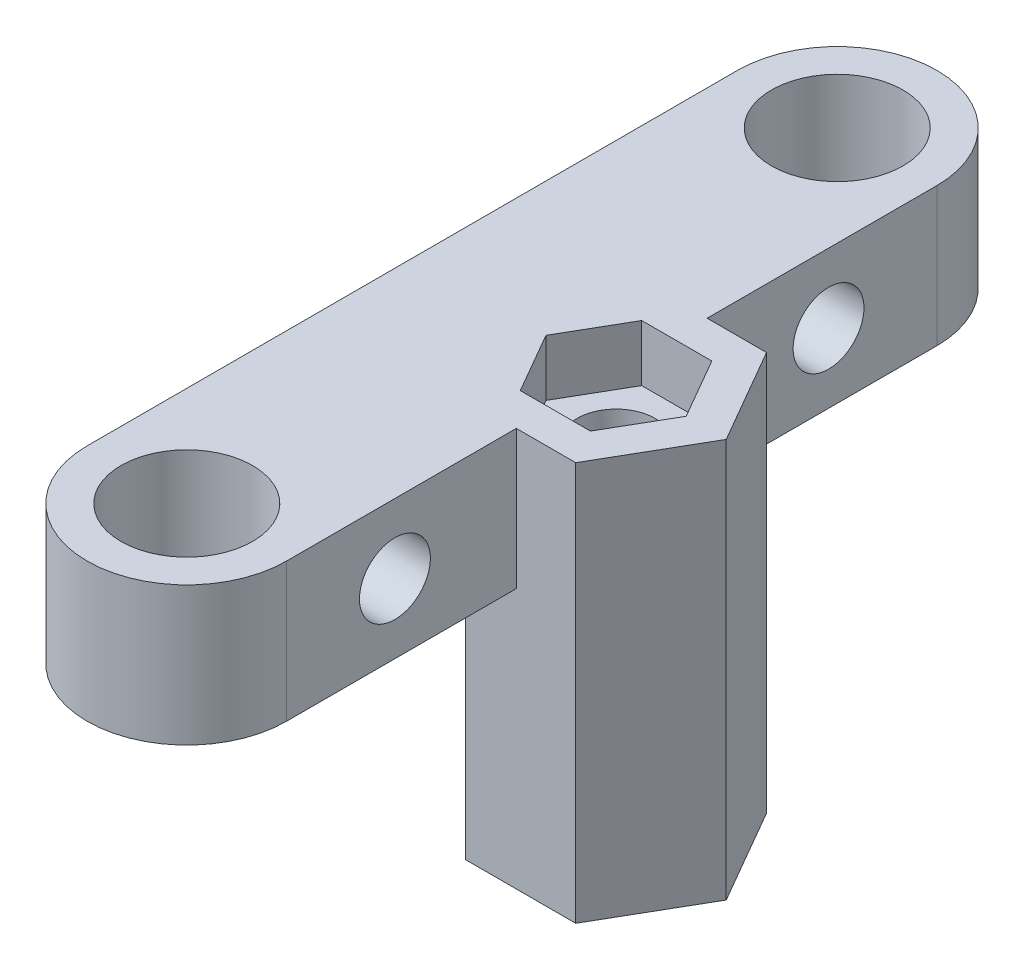
from build123d import *

# Parameters (mm, degrees)
SKETCH1_R           = 7.5875
BOSS_EXTRUDE1_DEPTH = 16
SKETCH2_R           = 4.0875
CUT_EXTRUDE1_DEPTH  = 63.988598267
SKETCH1_6_R         = 4.5
BOSS_EXTRUDE2_DEPTH = 9.5
BOSS_EXTRUDE3_DEPTH = 30


with BuildPart() as part:
    # Sketch1 → Boss-Extrude1 (new body)
    with BuildSketch(Plane(origin=(0, 0, 0), x_dir=(1, 0, 0), z_dir=(0, 1, 0))):
        with BuildLine():
            Line((-23.5, -33), (-23.5, 33))
            Line((-23.5, 33), (-23.5, 37.5))
            ThreePointArc((-23.5, 37.5), (-12, 49), (-0.5, 37.5))
            Line((-0.5, 37.5), (-0.5, 33))
            Line((-0.5, 33), (-0.5, 11))
            Line((-0.5, 11), (6.350852961, 11))
            Line((6.350852961, 11), (12.701705922, 0))
            Line((12.701705922, 0), (6.350852961, -11))
            Line((6.350852961, -11), (-0.5, -11))
            Line((-0.5, -11), (-0.5, -33))
            Line((-0.5, -33), (-0.5, -37.5))
            ThreePointArc((-0.5, -37.5), (-12, -49), (-23.5, -37.5))
            Line((-23.5, -37.5), (-23.5, -33))
        make_face()
        with Locations(Location((-12, -37.5, 0), (0, 0, 270))):
            Circle(SKETCH1_R, mode=Mode.SUBTRACT)
        with Locations(Location((-12, 37.5, 0), (0, 0, 270))):
            Circle(SKETCH1_R, mode=Mode.SUBTRACT)
        Polygon((8.082903769, 0), (4.041451884, 7), (-4.041451884, 7), (-8.082903769, 0), (-4.041451884, -7), (4.041451884, -7), align=None, mode=Mode.SUBTRACT)
    extrude(amount=BOSS_EXTRUDE1_DEPTH)

    # Sketch2 → Cut-Extrude1 (cut, through all)
    with BuildSketch(Plane.ZY.offset(23.5)):
        with Locations((-25, 8)):
            Circle(SKETCH2_R)
        with Locations((25, 8)):
            Circle(SKETCH2_R)
    extrude(amount=-CUT_EXTRUDE1_DEPTH, mode=Mode.SUBTRACT)

    # Sketch1<6> → Boss-Extrude2 (add)
    with BuildSketch(Plane(origin=(0, 0, 0), x_dir=(1, 0, 0), z_dir=(0, 1, 0))):
        Polygon((-4.041451884, -7), (4.041451884, -7), (8.082903769, 0), (4.041451884, 7), (-4.041451884, 7), (-8.082903769, 0), align=None)
        with Locations(Location((0, 0, 0), (0, 0, 270))):
            Circle(SKETCH1_6_R, mode=Mode.SUBTRACT)
    extrude(amount=BOSS_EXTRUDE2_DEPTH)

    # Sketch4 → Boss-Extrude3 (add)
    with BuildSketch(Plane.XZ):
        Polygon((12.701705922, 0), (6.350852961, 11), (-6.350852961, 11), (-12.701705922, 0), (-6.350852961, -11), (6.350852961, -11), align=None)
        Polygon((8.082903769, 0), (4.041451884, 7), (-4.041451884, 7), (-8.082903769, 0), (-4.041451884, -7), (4.041451884, -7), align=None, mode=Mode.SUBTRACT)
    extrude(amount=BOSS_EXTRUDE3_DEPTH)


solid = part.part
